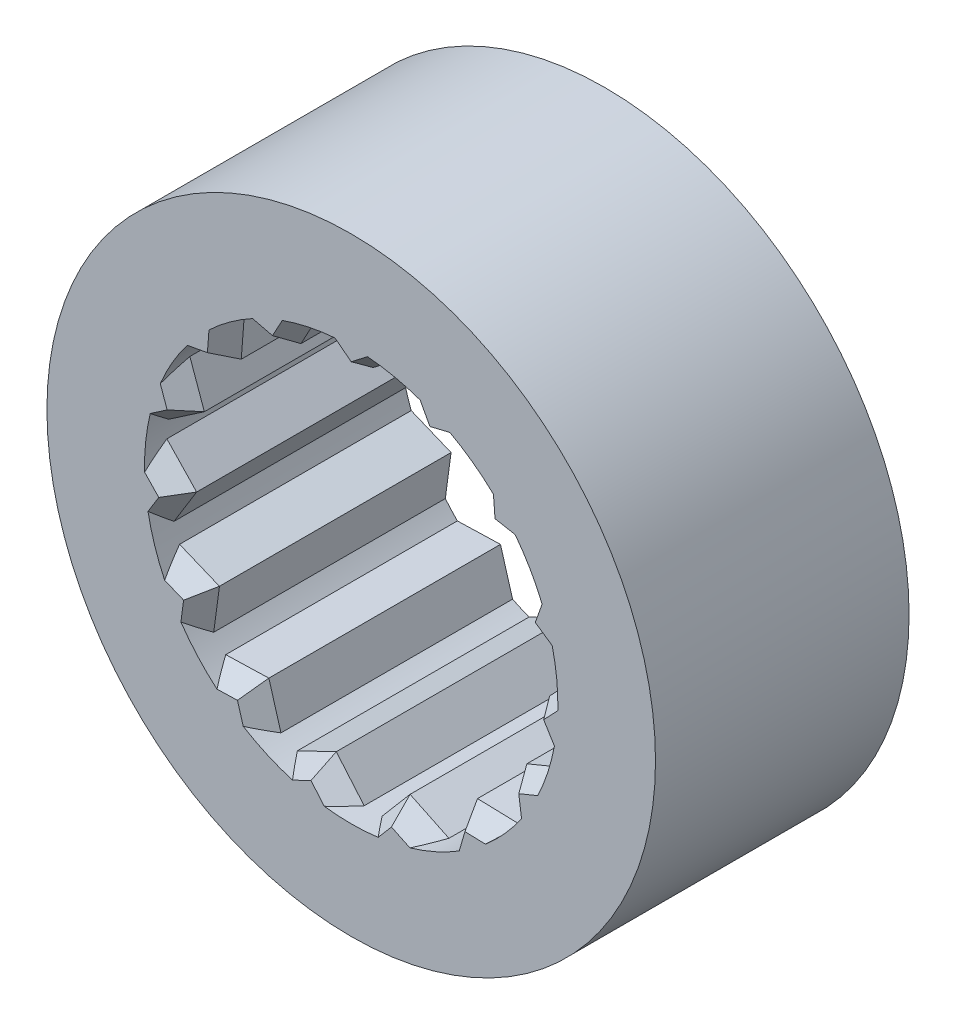
from build123d import *

# Parameters (mm, degrees)
SKETCH1_R                          = 6
SKETCH1_R_2                        = 4.075
RING_DEPTH                         = 5
SINGLE_TEETH_DEPTH                 = 5
TEETHCHAMPFER_SIZE                 = 0.25
TEETHCHAMPFER_SIZE2                = 0.433012702
F_15TH_TEETHS_COUNT                = 15
TEETHCHAMPFER_OF_15TH_TEETHS_SIZE2 = 0.433012702
TEETHCHAMPFER_OF_15TH_TEETHS_SIZE  = 0.25


with BuildPart() as part:
    # Sketch1 → ring (new body)
    with BuildSketch(Plane.XY):
        Circle(SKETCH1_R)
        Circle(SKETCH1_R_2, mode=Mode.SUBTRACT)
    extrude(amount=RING_DEPTH)

    # Sketch1<4> → single teeth (add)
    with BuildSketch(Plane.XY):
        with BuildLine():
            Line((-0.673142232, 4.019017857), (0, 3.5))
            Line((0, 3.5), (0.673142232, 4.019017857))
            ThreePointArc((0.673142232, 4.019017857), (0, 4.075), (-0.673142232, 4.019017857))
        make_face()
    single_teeth = extrude(amount=SINGLE_TEETH_DEPTH)

    # teethChampfer
    teethchampfer_edges = [part.edges().sort_by_distance(p)[0] for p in [
        (-0.336571116, 3.759508929, 5),
        (0.336571116, 3.759508929, 5),
    ]]
    teethchampfer_side = [part.faces().sort_by_distance(p)[0] for p in [
        (-5.830294373, 0, 5),
    ]]
    chamfer(teethchampfer_edges, length=TEETHCHAMPFER_SIZE, length2=TEETHCHAMPFER_SIZE2, reference=teethchampfer_side[0])

    # 15th teeths: single teeth ×15 about axis
    f_15th_teeths_axis = Axis((0, 0, 0), (0, 0, 1))
    for i in range(1, F_15TH_TEETHS_COUNT):
        add(single_teeth.rotate(f_15th_teeths_axis, i * 360 / F_15TH_TEETHS_COUNT))

    # teethChampfer of 15th teeths
    teethchampfer_of_15th_teeths_edges = [part.edges().sort_by_distance(p)[0] for p in [
        (-1.836603055, 3.297586499, 5),
        (-1.221657027, 3.57137811, 5),
        (-3.019069641, 2.265481406, 5),
        (-2.568649572, 2.765723572, 5),
        (-3.679511659, 0.841653997, 5),
        (-3.47149927, 1.481850302, 5),
        (-3.703732684, -0.727703035, 5),
        (-3.774095207, -0.058248347, 5),
        (-3.08754468, -2.171233601, 5),
        (-3.424115796, -1.588275328, 5),
        (-1.937492152, -3.239338152, 5),
        (-2.482075657, -2.843675076, 5),
        (-0.452429629, -3.747331708, 5),
        (-1.110862087, -3.607377569, 5),
        (1.110862087, -3.607377569, 5),
        (0.452429629, -3.747331708, 5),
        (2.482075657, -2.843675076, 5),
        (1.937492152, -3.239338152, 5),
        (3.424115796, -1.588275328, 5),
        (3.08754468, -2.171233601, 5),
        (3.774095207, -0.058248347, 5),
        (3.703732684, -0.727703035, 5),
        (3.47149927, 1.481850302, 5),
        (3.679511659, 0.841653997, 5),
        (2.568649572, 2.765723572, 5),
        (3.019069641, 2.265481406, 5),
        (1.221657027, 3.57137811, 5),
        (1.836603055, 3.297586499, 5),
    ]]
    chamfer(teethchampfer_of_15th_teeths_edges, length=TEETHCHAMPFER_OF_15TH_TEETHS_SIZE, length2=TEETHCHAMPFER_OF_15TH_TEETHS_SIZE2)


solid = part.part
